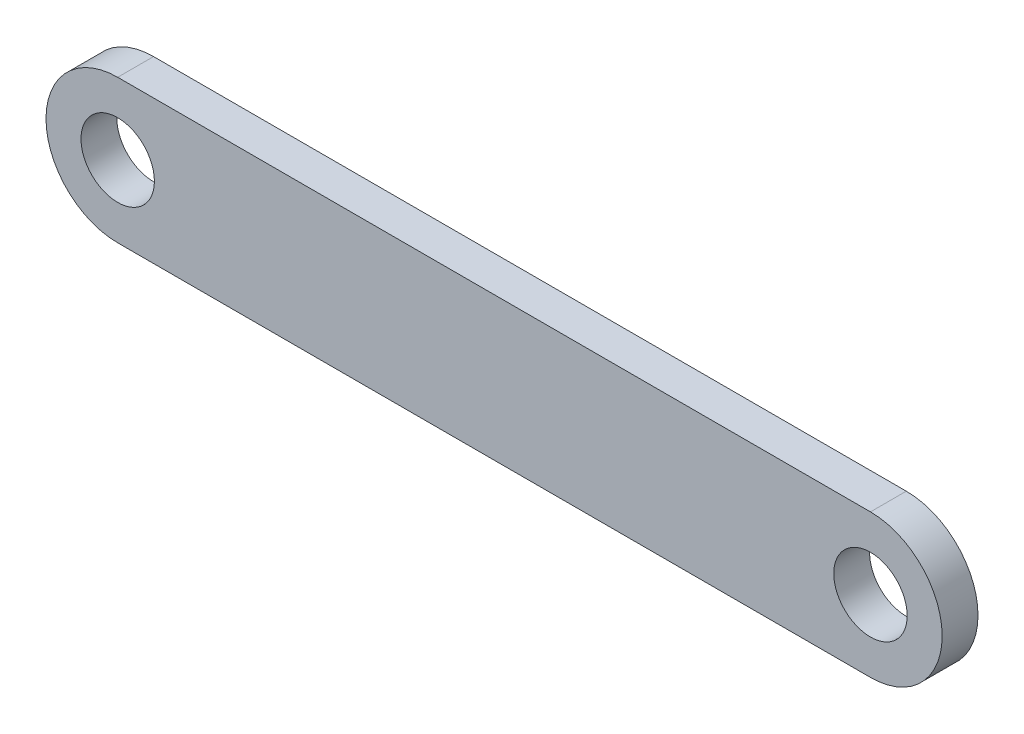
from build123d import *

# Parameters (mm, degrees)
SKETCH1_R           = 3.2512
BOSS_EXTRUDE1_DEPTH = 3.175


with BuildPart() as part:
    # Sketch1 → Boss-Extrude1 (new body)
    with BuildSketch(Plane.XY):
        with BuildLine():
            Line((0, 6.35), (66.675, 6.35))
            ThreePointArc((66.675, 6.35), (73.025, 0), (66.675, -6.35))
            Line((66.675, -6.35), (0, -6.35))
            ThreePointArc((0, -6.35), (-6.35, 0), (0, 6.35))
        make_face()
        Circle(SKETCH1_R, mode=Mode.SUBTRACT)
        with Locations((66.675, 0)):
            Circle(SKETCH1_R, mode=Mode.SUBTRACT)
    extrude(amount=BOSS_EXTRUDE1_DEPTH)


solid = part.part
